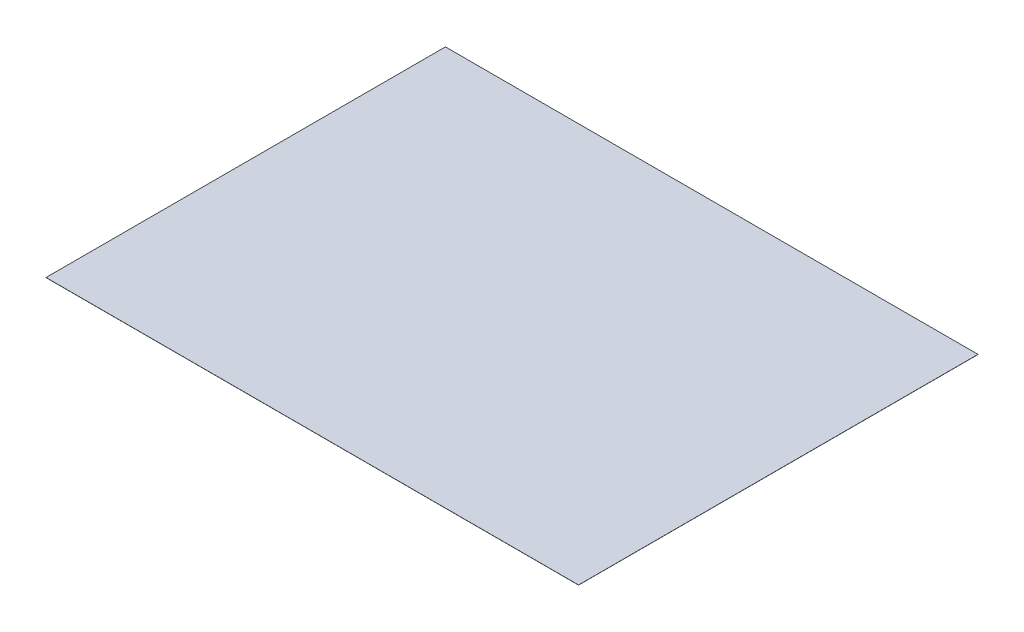
from build123d import *

# Parameters (mm, degrees)
SKETCH1_W           = 400
SKETCH1_H           = 300
BOSS_EXTRUDE1_DEPTH = 0.1


with BuildPart() as part:
    # Sketch1 → Boss-Extrude1 (new body)
    with BuildSketch(Plane(origin=(0, 0, 0), x_dir=(1, 0, 0), z_dir=(0, 1, 0))):
        Rectangle(SKETCH1_W, SKETCH1_H)
    extrude(amount=BOSS_EXTRUDE1_DEPTH)


solid = part.part
